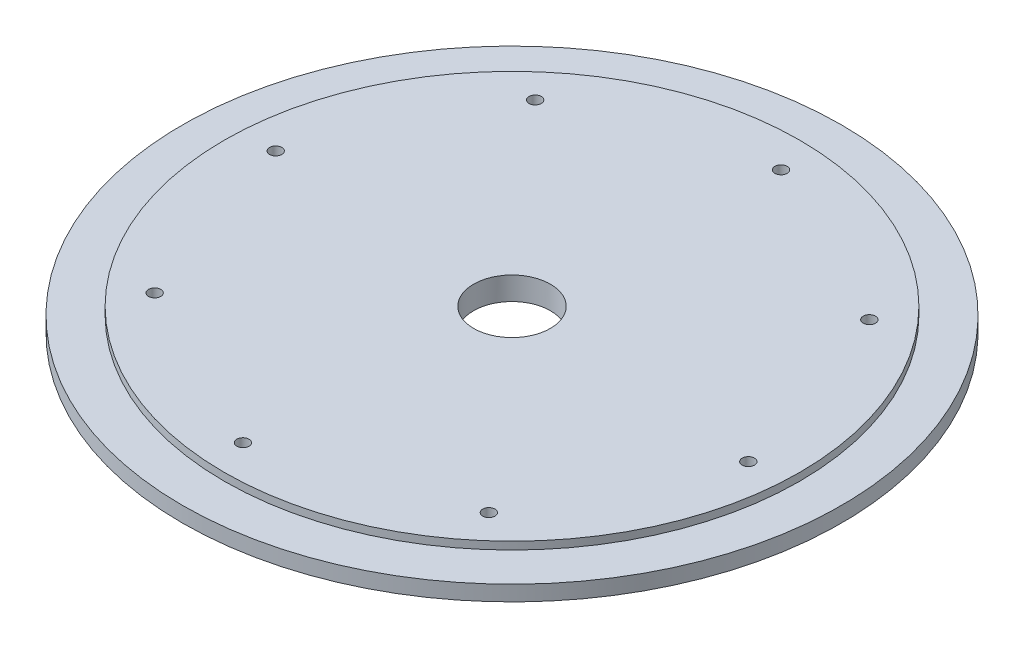
from build123d import *

# Parameters (mm, degrees)
SKETCH_1_R               = 43
EXTRUDE_1_DEPTH          = 1
SKETCH_2_R               = 37.5
EXTRUDE_2_DEPTH          = 1
SKETCH_3_R               = 5
CUT_EXTRUDE_1_DEPTH      = 50
SKETCH_4_R               = 43
SKETCH_4_R_2             = 5
EXTRUDE_3_DEPTH          = 1
SKETCH_5_OUTSIDE_W       = 112.332
SKETCH_5_OUTSIDE_H       = 112.332
SKETCH_5_OUTSIDE_R       = 42.95
CUT_EXTRUDE_2_DEPTH      = 500
SKETCH_6_R               = 0.8
CUT_EXTRUDE_3_DEPTH      = 500
PATTERN_CIRCULAR_1_COUNT = 8


with BuildPart() as part:
    # 草图1 → 凸台-拉伸1 (new body)
    with BuildSketch(Plane(origin=(0, 0, 0), x_dir=(1, 0, 0), z_dir=(0, 1, 0))):
        with Locations(Location((0, 0, 0), (0, 0, 270))):
            Circle(SKETCH_1_R)
    extrude(amount=EXTRUDE_1_DEPTH)

    # 草图2 → 凸台-拉伸2 (add)
    with BuildSketch(Plane(origin=(0, 1, 0), x_dir=(1, 0, 0), z_dir=(0, 1, 0))):
        with Locations(Location((0, 0, 0), (0, 0, 270))):
            Circle(SKETCH_2_R)
    extrude(amount=EXTRUDE_2_DEPTH)

    # 草图3 → 切除-拉伸1 (cut)
    with BuildSketch(Plane(origin=(0, 2, 0), x_dir=(1, 0, 0), z_dir=(0, 1, 0))):
        with Locations(Location((0, 0, 0), (0, 0, 270))):
            Circle(SKETCH_3_R)
    extrude(amount=-CUT_EXTRUDE_1_DEPTH, mode=Mode.SUBTRACT)

    # 草图4 → 凸台-拉伸3 (add)
    with BuildSketch(Plane.XZ):
        with Locations(Location((0, 0, 0), (0, 0, 270))):
            Circle(SKETCH_4_R)
        with Locations(Location((0, 0, 0), (0, 0, 90))):
            Circle(SKETCH_4_R_2, mode=Mode.SUBTRACT)
    extrude(amount=EXTRUDE_3_DEPTH)

    # 草图5 outside → 切除-拉伸2 (cut)
    with BuildSketch(Plane.XZ.offset(1)):
        Rectangle(SKETCH_5_OUTSIDE_W, SKETCH_5_OUTSIDE_H)
        with Locations(Location((0, 0, 0), (0, 0, 270))):
            Circle(SKETCH_5_OUTSIDE_R, mode=Mode.SUBTRACT)
    extrude(amount=-CUT_EXTRUDE_2_DEPTH, mode=Mode.SUBTRACT)

    # 草图6 → 切除-拉伸3 (cut)
    with BuildSketch(Plane.XZ.offset(1)):
        with Locations(Location((24.794413226, -21.776984933, 0), (0, 0, 270))):
            Circle(SKETCH_6_R)
    cut_extrude_3 = extrude(amount=-CUT_EXTRUDE_3_DEPTH, mode=Mode.SUBTRACT)

    # 阵列(圆周)1: 切除-拉伸3 ×8 about axis
    pattern_circular_1_axis = Axis((0, 0, 0), (0, 1, 0))
    for i in range(1, PATTERN_CIRCULAR_1_COUNT):
        add(cut_extrude_3.rotate(pattern_circular_1_axis, i * 360 / PATTERN_CIRCULAR_1_COUNT), mode=Mode.SUBTRACT)


solid = part.part
